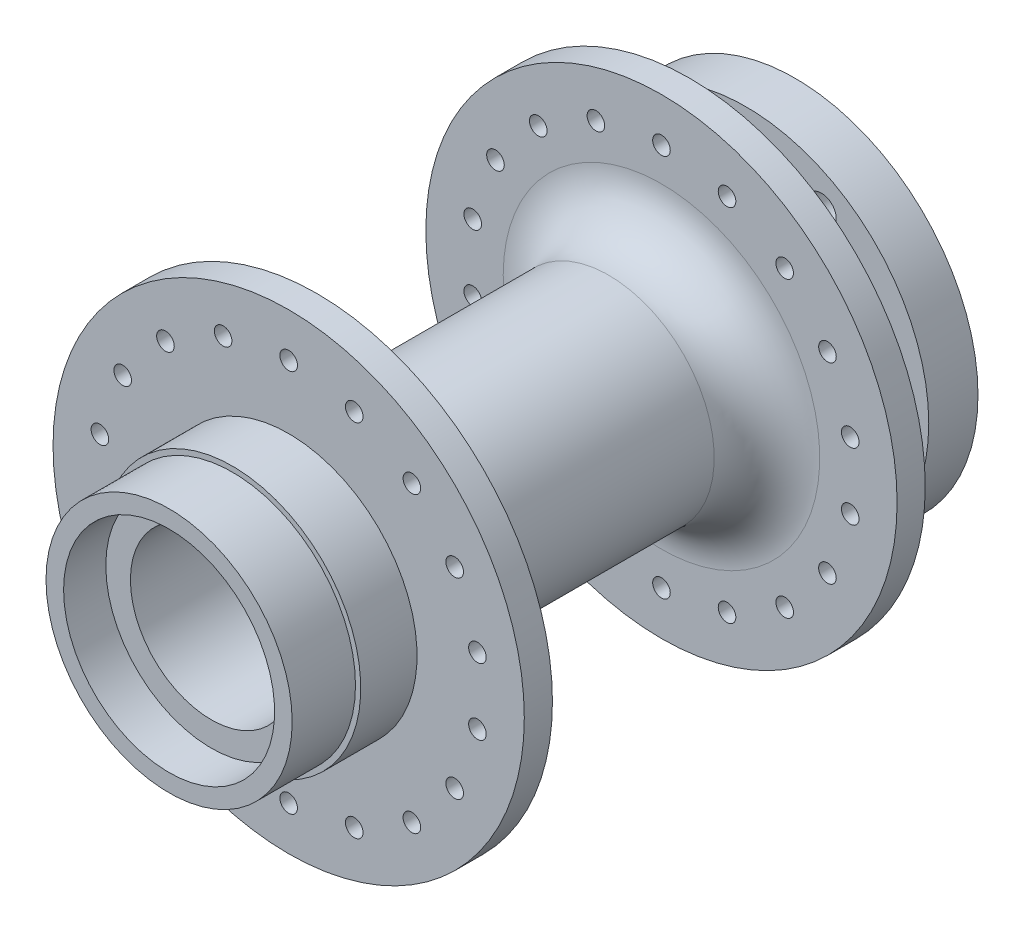
from build123d import *

# Parameters (mm, degrees)
FILLET1_R                 = 7.5
FILLET2_R                 = 2.5
CUT_EXTRUDE1_DEPTH        = 67.034082109
CUT_EXTRUDE1_DEPTH_BACK   = 67.034082109
SKETCH3_R                 = 1.25
M5X0_8_TAPPED_HOLE1_D     = 4.2
M5X0_8_TAPPED_HOLE1_DEPTH = 7.000101775


with BuildPart() as part:
    # Sketch2 → Revolve1 (revolve)
    with BuildSketch(Plane(origin=(0, 0, 0), x_dir=(1, 0, 0), z_dir=(0, 1, 0)), mode=Mode.PRIVATE) as revolve1_sk:
        Polygon((15, 46), (16, 46), (16, 43), (26, 43), (26, 35.999898225), (18.25, 35.999898225), (18.25, 27.999898225), (33.5, 27.999898225), (33.5, 23.999898225), (15, 23.999898225), (15, -25.000101775), (33.5, -25.000101775), (33.5, -29.000101775), (18.25, -29.000101775), (18.25, -37.000101775), (17.5, -37.000101775), (17.5, -46), (15, -46), (15, -40), (11.5, -40), (11.5, 40), (15, 40), align=None)
    revolve(revolve1_sk.sketch.rotate(Axis((0, 0, -29.097498156), (0, 0, 1)), 180), axis=Axis((0, 0, -29.097498156), (0, 0, 1)))

    # Fillet1
    fillet1_edges = [part.edges().sort_by_distance(p)[0] for p in [
        (15, 0, 25.000101775),
        (15, 0, -23.999898225),
    ]]
    fillet(fillet1_edges, radius=FILLET1_R)

    # Fillet2
    fillet2_edges = [part.edges().sort_by_distance(p)[0] for p in [
        (18.25, 0, -35.999898225),
    ]]
    fillet(fillet2_edges, radius=FILLET2_R)

    # Sketch3 → Cut-Extrude1 (cut, two sides: drawn at the far end of the back side and taken through both)
    with BuildSketch(Plane.XY.offset(-CUT_EXTRUDE1_DEPTH_BACK)):
        with Locations((0, 27.25)):
            Circle(SKETCH3_R)
        with Locations((9.320048906, 25.606623916)):
            Circle(SKETCH3_R)
        with Locations((17.515962364, 20.874711075)):
            Circle(SKETCH3_R)
        with Locations((23.599192253, 13.625)):
            Circle(SKETCH3_R)
        with Locations((26.83601127, 4.731912841)):
            Circle(SKETCH3_R)
        with Locations((26.83601127, -4.731912841)):
            Circle(SKETCH3_R)
        with Locations((23.599192253, -13.625)):
            Circle(SKETCH3_R)
        with Locations((17.515962364, -20.874711075)):
            Circle(SKETCH3_R)
        with Locations((9.320048906, -25.606623916)):
            Circle(SKETCH3_R)
        with Locations((0, -27.25)):
            Circle(SKETCH3_R)
        with Locations((-9.320048906, -25.606623916)):
            Circle(SKETCH3_R)
        with Locations((-17.515962364, -20.874711075)):
            Circle(SKETCH3_R)
        with Locations((-23.599192253, -13.625)):
            Circle(SKETCH3_R)
        with Locations((-26.83601127, -4.731912841)):
            Circle(SKETCH3_R)
        with Locations((-26.83601127, 4.731912841)):
            Circle(SKETCH3_R)
        with Locations((-23.599192253, 13.625)):
            Circle(SKETCH3_R)
        with Locations((-17.515962364, 20.874711075)):
            Circle(SKETCH3_R)
        with Locations((-9.320048906, 25.606623916)):
            Circle(SKETCH3_R)
    extrude(amount=CUT_EXTRUDE1_DEPTH + CUT_EXTRUDE1_DEPTH_BACK, mode=Mode.SUBTRACT)

    # M5x0.8 Tapped Hole1
    with Locations(Plane(origin=(0, 0, -43), x_dir=(-1, 0, 0), z_dir=(0, 0, -1))):
        with Locations((-10.75, 18.619546181), (10.75, 18.619546181), (21.5, 0), (10.75, -18.619546181), (-10.75, -18.619546181), (-21.5, 0)):
            Hole(M5X0_8_TAPPED_HOLE1_D / 2, depth=M5X0_8_TAPPED_HOLE1_DEPTH)


solid = part.part
